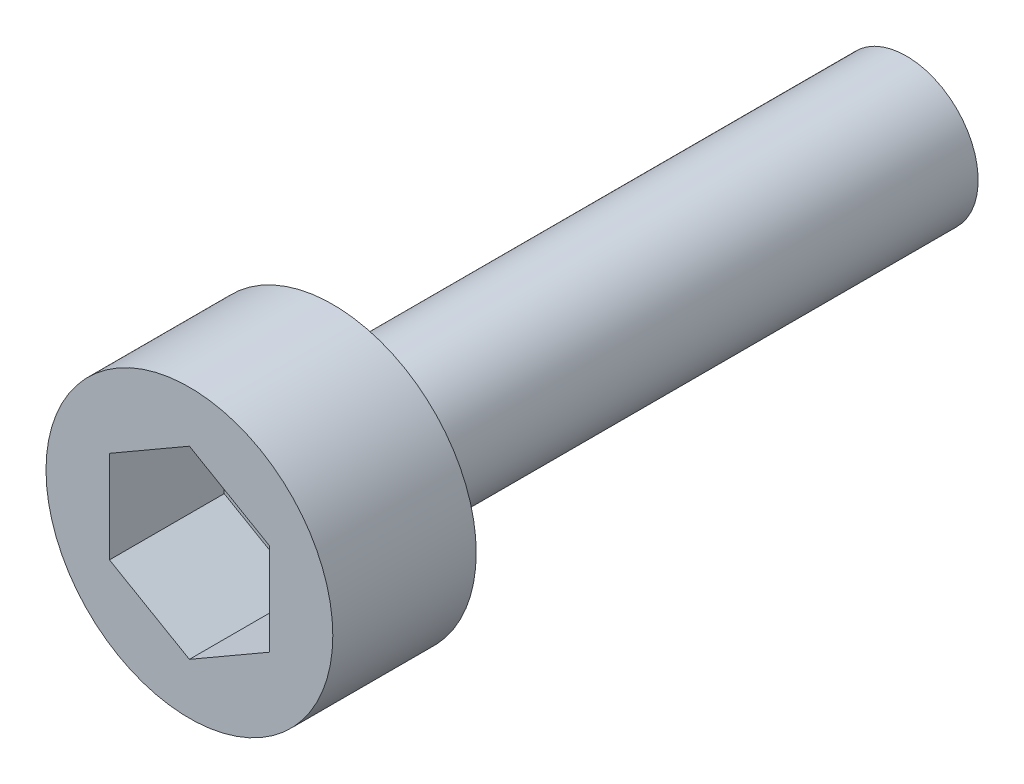
from build123d import *

# Parameters (mm, degrees)
SKETCH1_R           = 5
BOSS_EXTRUDE1_DEPTH = 5
SKETCH2_R           = 2.5
BOSS_EXTRUDE2_DEPTH = 20
CUT_EXTRUDE1_DEPTH  = 4


with BuildPart() as part:
    # Sketch1 → Boss-Extrude1 (new body)
    with BuildSketch(Plane.XY):
        with Locations((367.033440134, -490)):
            Circle(SKETCH1_R)
    extrude(amount=BOSS_EXTRUDE1_DEPTH)

    # Sketch2 → Boss-Extrude2 (add)
    with BuildSketch(Plane(origin=(0, 0, 0), x_dir=(-1, 0, 0), z_dir=(0, 0, -1))):
        with Locations((-367.033440134, -490)):
            Circle(SKETCH2_R)
    extrude(amount=BOSS_EXTRUDE2_DEPTH)

    # Sketch3 → Cut-Extrude1 (cut)
    with BuildSketch(Plane.XY.offset(5)):
        Polygon((367.033440134, -493.218193517), (369.820477474, -491.609096758), (369.820477474, -488.390903242), (367.033440134, -486.781806483), (364.246402794, -488.390903242), (364.246402794, -491.609096758), align=None)
    extrude(amount=-CUT_EXTRUDE1_DEPTH, mode=Mode.SUBTRACT)


solid = part.part
